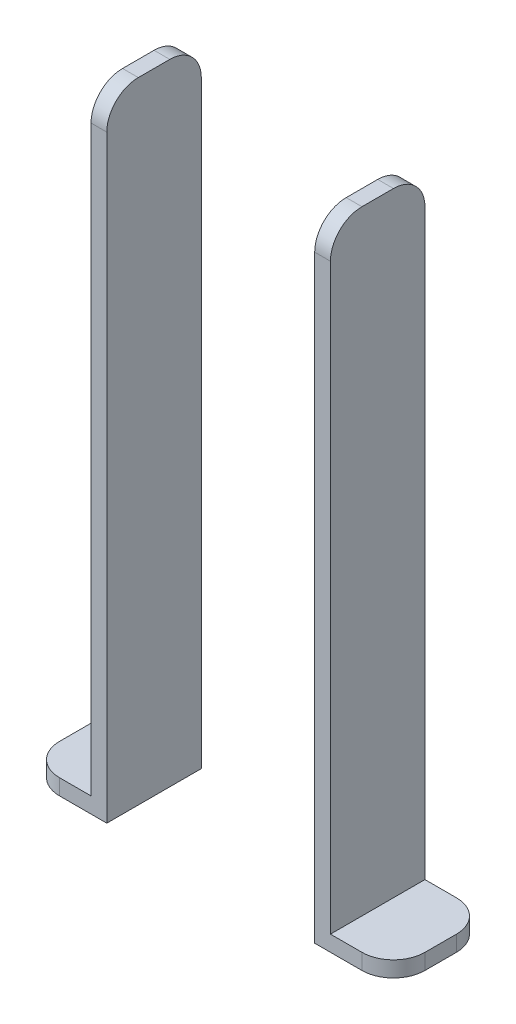
from build123d import *

# Parameters (mm, degrees)
BOSS_EXTRUDE3_DEPTH        = 15
BOSS_EXTRUDE3_DEPTH_BACK   = 15
BOSS_EXTRUDE3_2_DEPTH      = 15
BOSS_EXTRUDE3_2_DEPTH_BACK = 15
FILLET1_R                  = 10
FILLET2_R                  = 10


with BuildPart() as part:
    # Sketch5 → Boss-Extrude3 (new, two sides: drawn at the far end of the back side and taken through both)
    with BuildSketch(Plane.XY.offset(-BOSS_EXTRUDE3_DEPTH_BACK)):
        Polygon((33, 100), (33, -100), (58, -100), (58, -95), (38, -95), (38, 100), align=None)
    extrude(amount=BOSS_EXTRUDE3_DEPTH + BOSS_EXTRUDE3_DEPTH_BACK)

    # Fillet1
    fillet1_edges = [part.edges().sort_by_distance(p)[0] for p in [
        (58, -97.5, -15),
        (58, -97.5, 15),
        (35.5, 100, -15),
        (35.5, 100, 15),
    ]]
    fillet(fillet1_edges, radius=FILLET1_R)


with BuildPart() as body_2:
    # Sketch5 → Boss-Extrude3 2 (new, two sides: drawn at the far end of the back side and taken through both)
    with BuildSketch(Plane.XY.offset(-BOSS_EXTRUDE3_2_DEPTH_BACK)):
        Polygon((-38, 100), (-33, 100), (-33, -100), (-58, -100), (-58, -95), (-38, -95), align=None)
    extrude(amount=BOSS_EXTRUDE3_2_DEPTH + BOSS_EXTRUDE3_2_DEPTH_BACK)

    # Fillet2
    fillet2_edges = [body_2.edges().sort_by_distance(p)[0] for p in [
        (-58, -97.5, -15),
        (-58, -97.5, 15),
        (-35.5, 100, -15),
        (-35.5, 100, 15),
    ]]
    fillet(fillet2_edges, radius=FILLET2_R)


solid = Compound([part.part, body_2.part])
